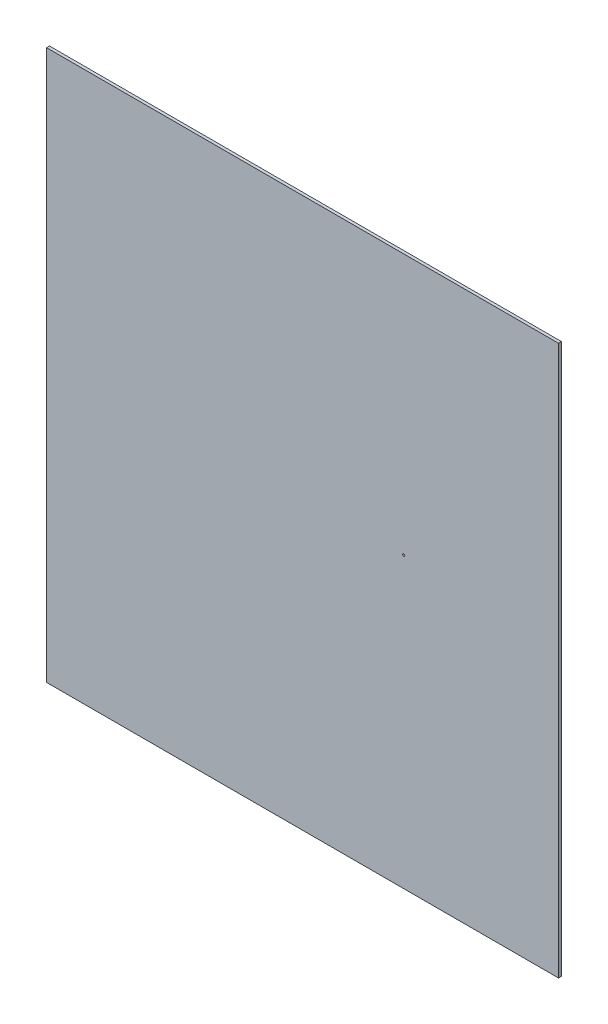
from build123d import *

# Parameters (mm, degrees)
SKETCH_1_W          = 68.997048069
SKETCH_1_H          = 74.099407003
BOARD_DEPTH         = 0.39116
SKETCH_2_R          = 0.15
CUT_EXTRUDE_1_DEPTH = 0.39116


with BuildPart() as part:
    # Эскиз1 → Board (new body)
    with BuildSketch(Plane.XY):
        with Locations((59.898524035, 59.711851368)):
            Rectangle(SKETCH_1_W, SKETCH_1_H)
    extrude(amount=BOARD_DEPTH)

    # Эскиз2 → Вырез-Вытянуть1 (cut)
    with BuildSketch(Plane.XY.offset(0.39116)):
        with Locations((73.533, 61.595)):
            Circle(SKETCH_2_R)
    extrude(amount=-CUT_EXTRUDE_1_DEPTH, mode=Mode.SUBTRACT)


solid = part.part
